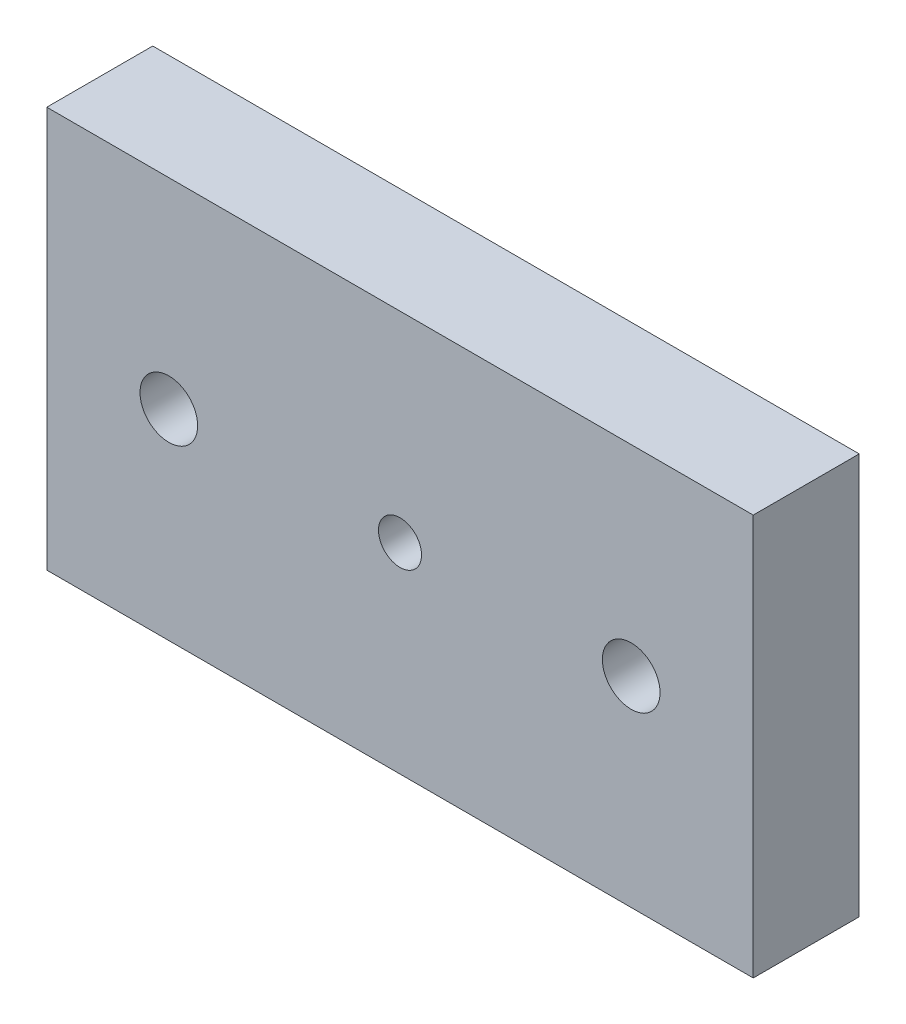
from build123d import *

# Parameters (mm, degrees)
SKETCH1_W             = 40
SKETCH1_H             = 22.7
BOSS_EXTRUDE1_DEPTH   = 6
F_4_CLEARANCE_HOLE1_D = 3.2639
F_2_CLEARANCE_HOLE1_D = 2.4384


with BuildPart() as part:
    # Sketch1 → Boss-Extrude1 (new body)
    with BuildSketch(Plane.XY):
        Rectangle(SKETCH1_W, SKETCH1_H)
    extrude(amount=-BOSS_EXTRUDE1_DEPTH)

    # #4 Clearance Hole1 (through all)
    with Locations(Plane.XY):
        with Locations((-13.09, 0), (13.09, 0)):
            Hole(F_4_CLEARANCE_HOLE1_D / 2)

    # #2 Clearance Hole1 (through all)
    with Locations(Plane.XY):
        with Locations((0, 0)):
            Hole(F_2_CLEARANCE_HOLE1_D / 2)


solid = part.part
